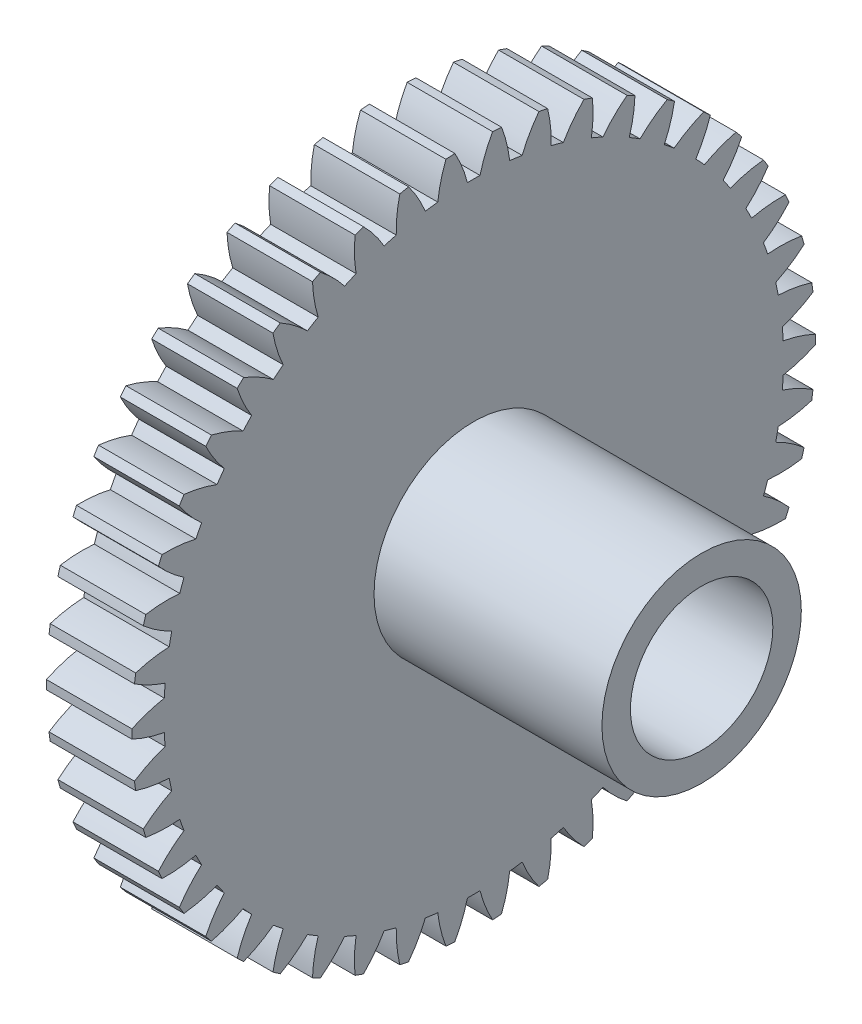
from build123d import *

# Parameters (mm, degrees)
BASPROSKE_W         = 6
BASPROSKE_H         = 24
TOOTHCUT_DEPTH      = 35.467375879
TEETHCUTS_COUNT     = 46
TEETHCUTS_ANGLE     = 352.173913043
SKETCH2_R           = 7
SKETCH2_R_2         = 5
BOSS_EXTRUDE1_DEPTH = 16
SKETCH3_R           = 15
CUT_EXTRUDE2_DEPTH  = 3


with BuildPart() as part:
    # BasProSke → Base-Revolve (revolve)
    with BuildSketch(Plane(origin=(0, 0, 0), x_dir=(1, 0, 0), z_dir=(0, 1, 0)), mode=Mode.PRIVATE) as base_revolve_sk:
        with Locations((3, 12)):
            Rectangle(BASPROSKE_W, BASPROSKE_H)
    revolve(base_revolve_sk.sketch.rotate(Axis((-10, 0, 0), (1, 0, 0)), 180), axis=Axis((-10, 0, 0), (1, 0, 0)))

    # TooCutSke → ToothCut (cut, through all)
    with BuildSketch(Plane(origin=(0, 0, 0), x_dir=(0, 0, -1), z_dir=(1, 0, 0))):
        with BuildLine():
            ThreePointArc((0.441526923, 21.744517814), (0, 21.749), (-0.441526923, 21.744517814))
            ThreePointArc((-0.441526923, 21.744517814), (-0.815896613, 22.895874179), (-1.338211282, 23.988101962))
            ThreePointArc((-1.338211282, 23.988101962), (0, 24.0254), (1.338211282, 23.988101962))
            ThreePointArc((1.338211282, 23.988101962), (0.815896613, 22.895874179), (0.441526923, 21.744517814))
        make_face()
    toothcut = extrude(amount=TOOTHCUT_DEPTH, mode=Mode.SUBTRACT)

    # TeethCuts: ToothCut ×46 about axis
    teethcuts_axis = Axis((-10, 0, 0), (1, 0, 0))
    for i in range(1, TEETHCUTS_COUNT):
        add(toothcut.rotate(teethcuts_axis, i * TEETHCUTS_ANGLE / (TEETHCUTS_COUNT - 1)), mode=Mode.SUBTRACT)

    # Sketch2 → Boss-Extrude1 (add)
    with BuildSketch(Plane(origin=(6, 0, 0), x_dir=(0, 0, -1), z_dir=(1, 0, 0))):
        with Locations(Location((0, 0, 0), (0, 0, 180))):
            Circle(SKETCH2_R)
        Circle(SKETCH2_R_2, mode=Mode.SUBTRACT)
    extrude(amount=BOSS_EXTRUDE1_DEPTH)

    # Sketch3 → Cut-Extrude2 (cut)
    with BuildSketch(Plane.ZY):
        Circle(SKETCH3_R)
    extrude(amount=-CUT_EXTRUDE2_DEPTH, mode=Mode.SUBTRACT)


solid = part.part
